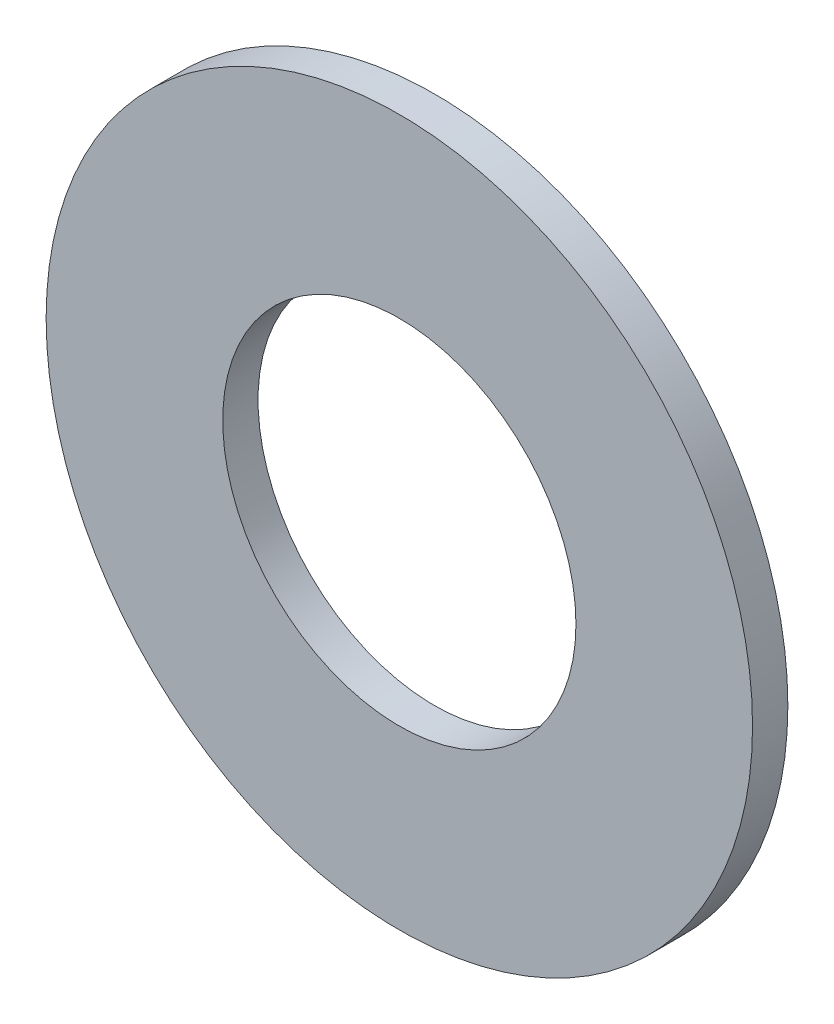
from build123d import *

# Parameters (mm, degrees)
SKETCH_1_R      = 5
SKETCH_1_R_2    = 2.5
EXTRUDE_1_DEPTH = 0.5


with BuildPart() as part:
    # 草图1 → 凸台-拉伸1 (new body)
    with BuildSketch(Plane.XY):
        Circle(SKETCH_1_R)
        Circle(SKETCH_1_R_2, mode=Mode.SUBTRACT)
    extrude(amount=EXTRUDE_1_DEPTH)


solid = part.part
